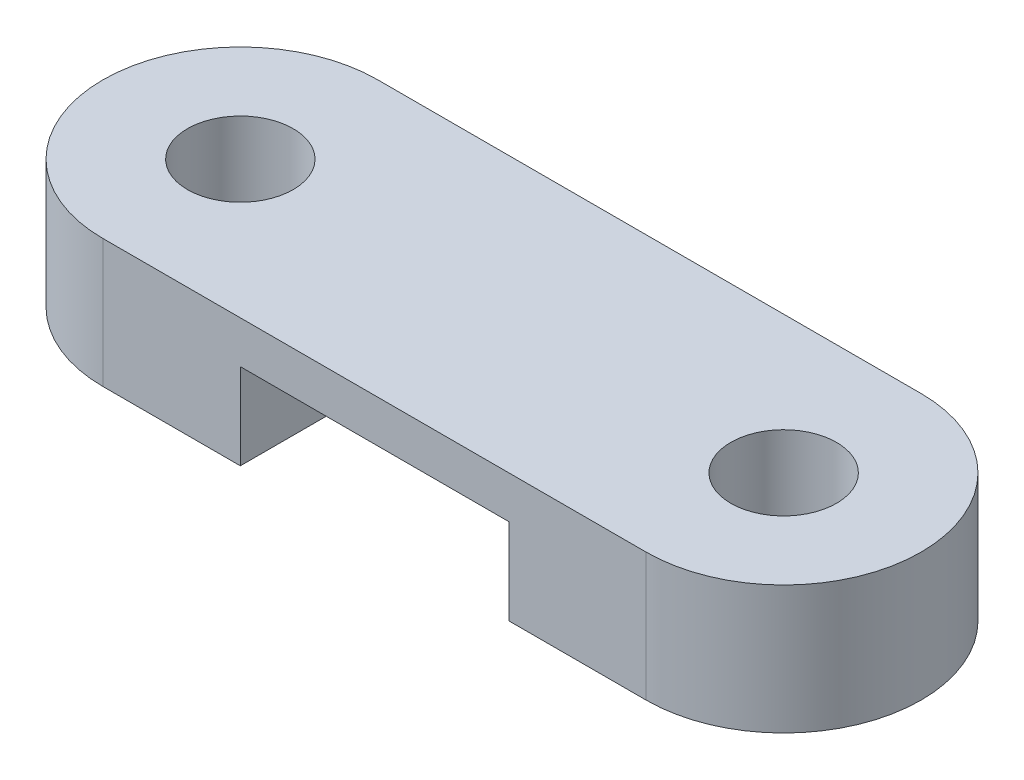
from build123d import *

# Parameters (mm, degrees)
SKETCH2_R           = 1.25
BOSS_EXTRUDE1_DEPTH = 1
BOSS_EXTRUDE2_START = -2.032
SKETCH2_3_R         = 1.25
BOSS_EXTRUDE2_DEPTH = 2.032


with BuildPart() as part:
    # Sketch2 → Boss-Extrude1 (new body)
    with BuildSketch(Plane(origin=(0, 0, 0), x_dir=(1, 0, 0), z_dir=(0, 1, 0))):
        with BuildLine():
            ThreePointArc((-6.425, 3.25), (-9.675, 0), (-6.425, -3.25))
            Line((-6.425, -3.25), (6.425, -3.25))
            ThreePointArc((6.425, -3.25), (9.675, 0), (6.425, 3.25))
            Line((6.425, 3.25), (-6.425, 3.25))
        make_face()
        with Locations((-6.425, 0)):
            Circle(SKETCH2_R, mode=Mode.SUBTRACT)
        with Locations((6.425, 0)):
            Circle(SKETCH2_R, mode=Mode.SUBTRACT)
    extrude(amount=BOSS_EXTRUDE1_DEPTH)

    # Sketch2<3> → Boss-Extrude2 (add)
    # profile 1 of 2: a face of its own
    with BuildSketch(Plane(origin=(0, 0, 0), x_dir=(1, 0, 0), z_dir=(0, 1, 0)).offset(BOSS_EXTRUDE2_START)):
        with BuildLine():
            Line((-3.175, 3.25), (-6.425, 3.25))
            ThreePointArc((-6.425, 3.25), (-9.675, 0), (-6.425, -3.25))
            Line((-6.425, -3.25), (-3.175, -3.25))
            Line((-3.175, -3.25), (-3.175, 3.25))
        make_face()
        with Locations((-6.425, 0)):
            Circle(SKETCH2_3_R, mode=Mode.SUBTRACT)
    # profile 2 of 2: a face of its own
    with BuildSketch(Plane(origin=(0, 0, 0), x_dir=(1, 0, 0), z_dir=(0, 1, 0)).offset(BOSS_EXTRUDE2_START)):
        with BuildLine():
            Line((6.425, 3.25), (3.175, 3.25))
            Line((3.175, 3.25), (3.175, -3.25))
            Line((3.175, -3.25), (6.425, -3.25))
            ThreePointArc((6.425, -3.25), (9.675, 0), (6.425, 3.25))
        make_face()
        with Locations((6.425, 0)):
            Circle(SKETCH2_3_R, mode=Mode.SUBTRACT)
    extrude(amount=BOSS_EXTRUDE2_DEPTH)


solid = part.part
